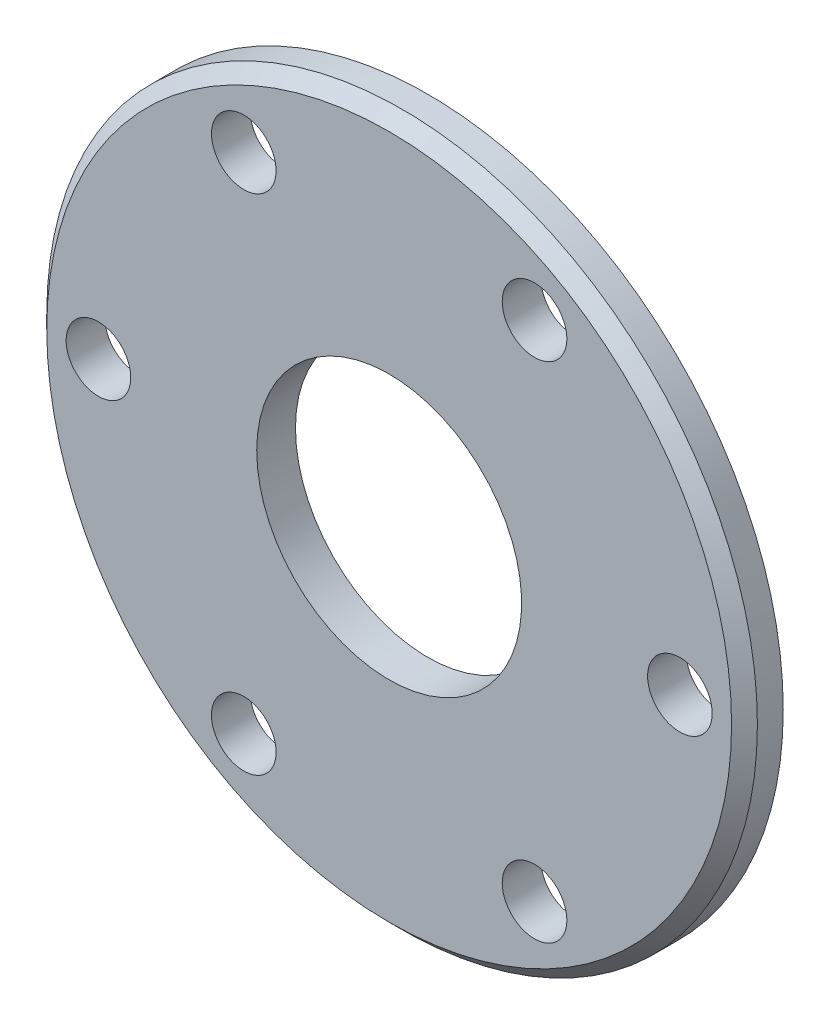
from build123d import *

# Parameters (mm, degrees)
SKETCH_1_W                = 27.5
SKETCH_1_H                = 3
HOLE_WIZARD_5_0_5_1_D     = 5
HOLE_WIZARD_20_5_20_5_1_D = 20.5
CHAMFER_1_SIZE            = 1.0000038
CHAMFER_1_SIZE2           = 1.000003965


with BuildPart() as part:
    # 草图1 → 旋转1 (revolve)
    with BuildSketch(Plane(origin=(0, 0, 0), x_dir=(1, 0, 0), z_dir=(0, 1, 0))):
        with Locations((13.75, -1.5)):
            Rectangle(SKETCH_1_W, SKETCH_1_H)
    revolve(axis=Axis((0, 0, 0), (0, 0, 1)))

    # Ø5.0 (5) 直径孔1 (through all)
    with Locations(Plane(origin=(0, 0, 0), x_dir=(-1, 0, 0), z_dir=(0, 0, -1))):
        with Locations((-22.5, 0), (-11.25, 19.485571585), (11.25, 19.485571585), (22.5, 0), (11.25, -19.485571585), (-11.25, -19.485571585)):
            Hole(HOLE_WIZARD_5_0_5_1_D / 2)

    # Ø20.5 (20.5) 直径孔1 (through all)
    with Locations(Plane(origin=(0, 0, 0), x_dir=(-1, 0, 0), z_dir=(0, 0, -1))):
        with Locations((0, 0)):
            Hole(HOLE_WIZARD_20_5_20_5_1_D / 2)

    # 倒角1
    chamfer_1_edges = [part.edges().sort_by_distance(p)[0] for p in [
        (-27.5, 0, 3),
    ]]
    chamfer_1_side = [part.faces().sort_by_distance(p)[0] for p in [
        (-27.5, 0, 1.5),
    ]]
    chamfer(chamfer_1_edges, length=CHAMFER_1_SIZE, length2=CHAMFER_1_SIZE2, reference=chamfer_1_side[0])


solid = part.part
